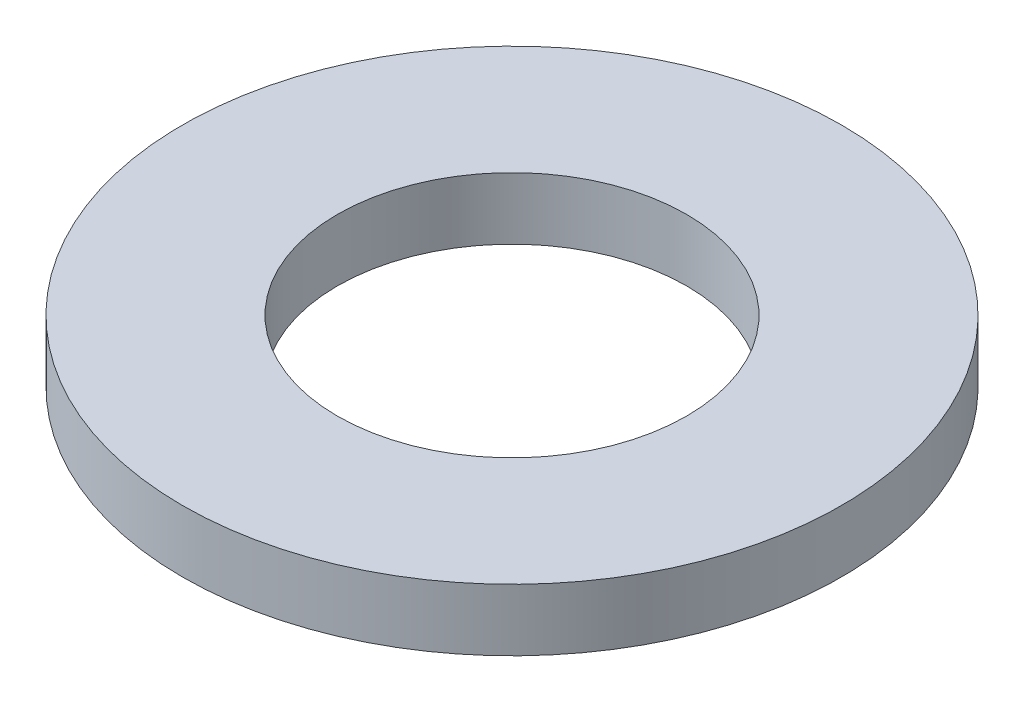
from build123d import *

# Parameters (mm, degrees)
SKETCH1_R           = 5
SKETCH1_R_2         = 2.65
BOSS_EXTRUDE1_DEPTH = 0.94


with BuildPart() as part:
    # Sketch1 → Boss-Extrude1 (new body)
    with BuildSketch(Plane(origin=(0, 0, 0), x_dir=(1, 0, 0), z_dir=(0, 1, 0))):
        with Locations(Location((0, 0, 0), (0, 0, 270))):
            Circle(SKETCH1_R)
        with Locations(Location((0, 0, 0), (0, 0, 270))):
            Circle(SKETCH1_R_2, mode=Mode.SUBTRACT)
    extrude(amount=BOSS_EXTRUDE1_DEPTH)


solid = part.part
